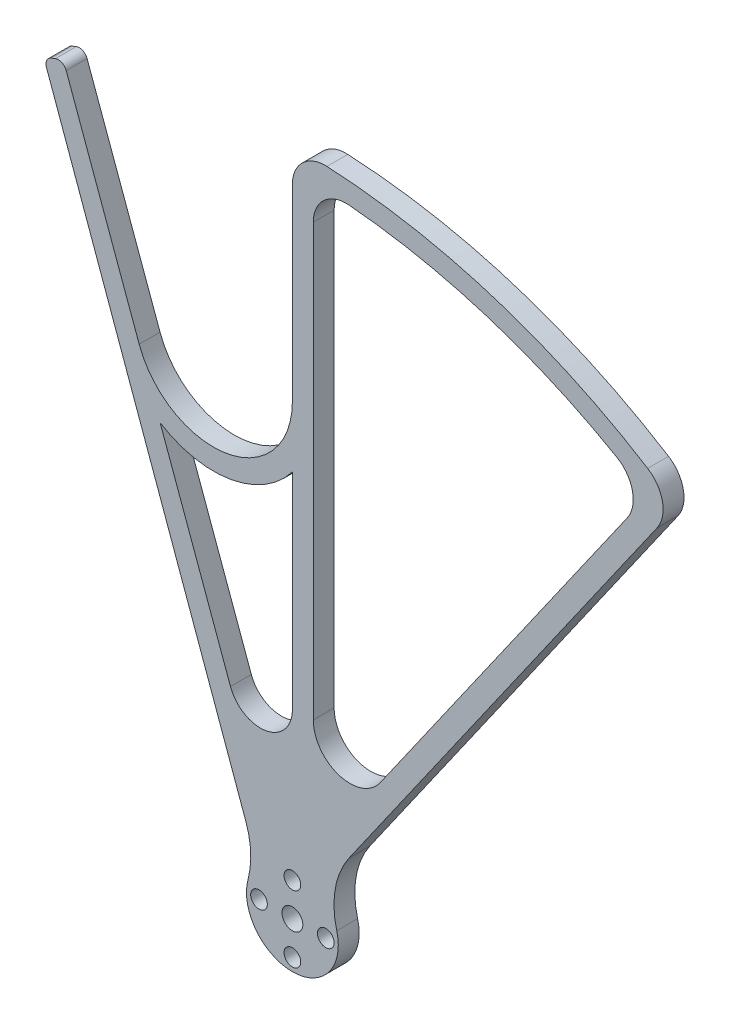
from build123d import *

# Parameters (mm, degrees)
SKETCH1_R          = 3.175
BASE_EXTRUDE_DEPTH = 6.35
FILLET1_R          = 10
FILLET2_R          = 2.54
SKETCH2_R          = 2.54
MOUNT_HOLES_DEPTH  = 233.825979653
FILLET3_R          = 25.24


with BuildPart() as part:
    # Sketch1 → Base Extrude (new body)
    with BuildSketch(Plane.XY):
        with BuildLine():
            Line((-75.671499827, 189.250953956), (-10.702976856, 8.978150501))
            ThreePointArc((-10.702976856, 8.978150501), (1.824481313, -13.850349019), (8.012862816, 11.443554059))
            Line((8.012862816, 11.443554059), (116.905655655, 166.9585791))
            ThreePointArc((116.905655655, 166.9585791), (61.289492424, 194.385435611), (0, 203.818790741))
            Line((0, 203.818790741), (0, 136.3309927))
            ThreePointArc((0, 136.3309927), (-19.864532894, 112.657364258), (-46.627945663, 128.109227825))
            Line((-46.627945663, 128.109227825), (-69.710132022, 191.527013637))
            ThreePointArc((-69.710132022, 191.527013637), (-72.699723739, 190.4123148), (-75.671499827, 189.250953956))
        make_face()
        Circle(SKETCH1_R, mode=Mode.SUBTRACT)
        with BuildLine():
            Line((26.680843247, 49.175080254), (108.003253412, 165.315518235))
            ThreePointArc((108.003253412, 165.315518235), (59.380010597, 188.329332974), (6.35, 197.366665921))
            Line((6.35, 197.366665921), (6.35, 55.585370506))
            ThreePointArc((6.35, 55.585370506), (14.165311985, 44.926629865), (26.680843247, 49.175080254))
        make_face(mode=Mode.SUBTRACT)
        with BuildLine():
            Line((0, 55.102439922), (0, 117.740251175))
            ThreePointArc((0, 117.740251175), (-18.761866966, 106.403835026), (-40.269537582, 110.639645198))
            Line((-40.269537582, 110.639645198), (-18.8461444, 51.779356182))
            ThreePointArc((-18.8461444, 51.779356182), (-8.02887303, 45.534001644), (0, 55.102439922))
        make_face(mode=Mode.SUBTRACT)
    extrude(amount=BASE_EXTRUDE_DEPTH)

    # Fillet1
    fillet1_edges = [part.edges().sort_by_distance(p)[0] for p in [
        (0, 203.818790741, 3.175),
        (116.905655655, 166.9585791, 3.175),
        (108.003253412, 165.315518235, 3.175),
        (6.35, 197.366665921, 3.175),
    ]]
    fillet(fillet1_edges, radius=FILLET1_R)

    # Fillet2
    fillet2_edges = [part.edges().sort_by_distance(p)[0] for p in [
        (-75.671499827, 189.250953956, 3.175),
        (-69.710132022, 191.527013637, 3.175),
    ]]
    fillet(fillet2_edges, radius=FILLET2_R)

    # Sketch2 → Mount Holes (cut, through all)
    with BuildSketch(Plane.XY.offset(6.35)):
        with Locations((0, 10.16)):
            Circle(SKETCH2_R)
        with Locations((10.16, 0)):
            Circle(SKETCH2_R)
        with Locations((0, -10.16)):
            Circle(SKETCH2_R)
        with Locations((-10.16, 0)):
            Circle(SKETCH2_R)
    extrude(amount=-MOUNT_HOLES_DEPTH, mode=Mode.SUBTRACT)

    # Fillet3
    fillet3_edges = [part.edges().sort_by_distance(p)[0] for p in [
        (8.012862816, 11.443554059, 3.175),
        (-10.702976856, 8.978150501, 3.175),
    ]]
    fillet(fillet3_edges, radius=FILLET3_R)


solid = part.part
